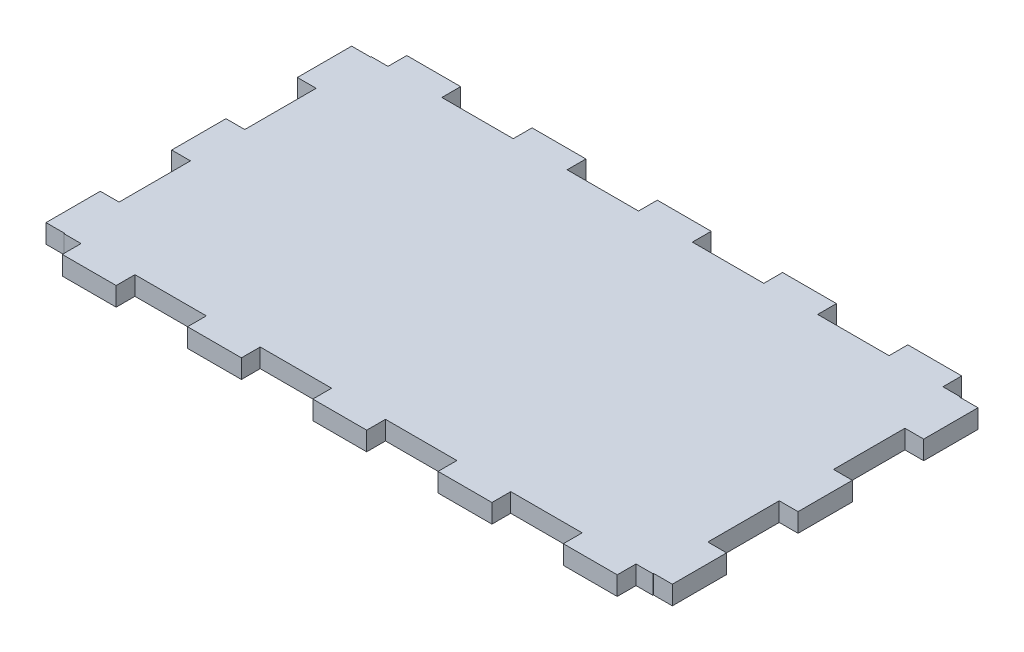
from build123d import *

# Parameters (mm, degrees)
BOSS_EXTRU_1_DEPTH = 3


with BuildPart() as part:
    # Esquisse1 → Boss.-Extru.1 (new body)
    with BuildSketch(Plane(origin=(0, 0, 0), x_dir=(1, 0, 0), z_dir=(0, 1, 0))):
        Polygon((3, 31.833333333), (0, 31.833333333), (0, 23.166666667), (3, 23.166666667), (3, 17.466666667), (3, 11.766666667), (0, 11.766666667), (0, 3.1), (3, 3.1), (3, 3), (5.7, 3), (5.7, 0), (14.3, 0), (14.3, 3), (25.7, 3), (25.7, 0), (34.3, 0), (34.3, 3), (45.7, 3), (45.7, 0), (54.3, 0), (54.3, 3), (65.7, 3), (65.7, 0), (74.3, 0), (74.3, 3), (85.7, 3), (85.7, 0), (94.3, 0), (94.3, 3), (97, 3), (97, 3.1), (100, 3.1), (100, 11.766666667), (97, 11.766666667), (97, 23.166666667), (100, 23.166666667), (100, 31.833333333), (97, 31.833333333), (97, 43.233333333), (100, 43.233333333), (100, 51.9), (97, 51.9), (97, 52), (94.3, 52), (94.3, 55), (85.7, 55), (85.7, 52), (74.3, 52), (74.3, 55), (65.7, 55), (65.7, 52), (54.3, 52), (54.3, 55), (45.7, 55), (45.7, 52), (34.3, 52), (34.3, 55), (25.7, 55), (25.7, 52), (20, 52), (14.3, 52), (14.3, 55), (5.7, 55), (5.7, 52), (3, 52), (3, 51.9), (0, 51.9), (0, 43.233333333), (3, 43.233333333), align=None)
    extrude(amount=BOSS_EXTRU_1_DEPTH)


solid = part.part
